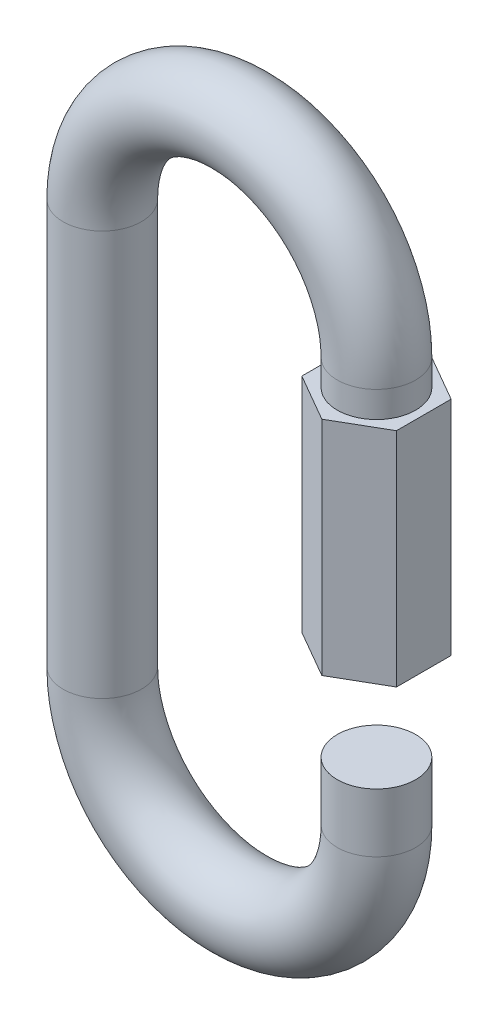
from build123d import *

# Parameters (mm, degrees)
SKETCH1_R           = 3
BOSS_EXTRUDE1_DEPTH = 17


with BuildPart() as part:
    # Sweep1: sweep along a path in Sketch2
    with BuildLine(Plane.XY) as sweep1_path:
        Line((0, 0), (0, 19))
        ThreePointArc((0, 19), (-10.5, 29.5), (-21, 19))
        Line((-21, 19), (-21, -12))
        ThreePointArc((-21, -12), (-10.5, -22.5), (0, -12))
        Line((0, -12), (0, -7.5))
    # Sketch1 → Sweep1 (sweep)
    with BuildSketch(Plane(origin=(0, 0, 0), x_dir=(1, 0, 0), z_dir=(0, 1, 0))):
        Circle(SKETCH1_R)
    sweep(path=sweep1_path.line)

    # Sketch3 → Boss-Extrude1 (add)
    with BuildSketch(Plane.XZ):
        Polygon((3.623304072, 2.091915581), (0, 4.183831163), (-3.623304072, 2.091915581), (-3.623304072, -2.091915581), (0, -4.183831163), (3.623304072, -2.091915581), align=None)
    extrude(amount=-BOSS_EXTRUDE1_DEPTH)


solid = part.part
